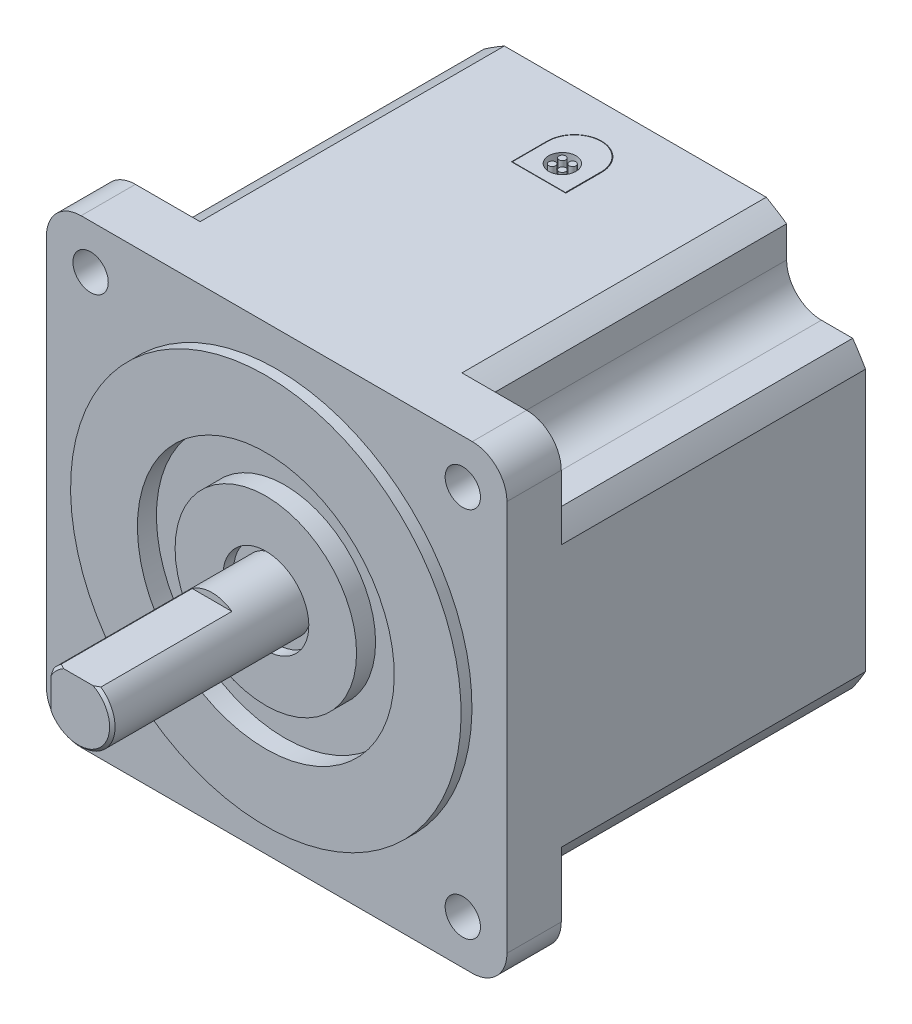
from build123d import *

# Parameters (mm, degrees)
BOSS_EXTRUDE1_DEPTH = 10.16
BOSS_EXTRUDE2_DEPTH = 56.896
SKETCH5_W           = 2.032
SKETCH5_H           = 36.5125
SKETCH6_W           = 3.556
SKETCH6_H           = 7.0485
SKETCH7_W           = 104.14
SKETCH7_H           = 6.35
CHAMFER1_SIZE       = 0.508
CUT_EXTRUDE1_START  = -24.9936
CUT_EXTRUDE1_DEPTH  = 24.9936
SKETCH9_R           = 3.302
CUT_EXTRUDE2_DEPTH  = 10.16
CUT_EXTRUDE3_DEPTH  = 1.9431
SKETCH11_R          = 2.54
BOSS_EXTRUDE3_DEPTH = 1.9685
SKETCH13_R          = 0.635
BOSS_EXTRUDE4_DEPTH = 1.9304


with BuildPart() as part:
    # Sketch3 → Boss-Extrude1 (new body)
    with BuildSketch(Plane.XY):
        with BuildLine():
            Line((-43.053, -36.576), (-43.053, 36.576))
            ThreePointArc((-43.053, 36.576), (-41.155930622, 41.155930622), (-36.576, 43.053))
            Line((-36.576, 43.053), (36.576, 43.053))
            ThreePointArc((36.576, 43.053), (41.155930622, 41.155930622), (43.053, 36.576))
            Line((43.053, 36.576), (43.053, -36.576))
            ThreePointArc((43.053, -36.576), (41.155930622, -41.155930622), (36.576, -43.053))
            Line((36.576, -43.053), (-36.576, -43.053))
            ThreePointArc((-36.576, -43.053), (-41.155930622, -41.155930622), (-43.053, -36.576))
        make_face()
    extrude(amount=-BOSS_EXTRUDE1_DEPTH)

    # Sketch4 → Boss-Extrude2 (add)
    with BuildSketch(Plane.XY.offset(-10.16)):
        with BuildLine():
            Line((-40.651936247, 28.2956), (-34.798, 28.2956))
            ThreePointArc((-34.798, 28.2956), (-30.200108866, 30.200108866), (-28.2956, 34.798))
            Line((-28.2956, 34.798), (-28.2956, 40.651936247))
            ThreePointArc((-28.2956, 40.651936247), (-26.419070342, 41.895747067), (-24.487958081, 43.053))
            Line((-24.487958081, 43.053), (24.487958081, 43.053))
            ThreePointArc((24.487958081, 43.053), (26.419070342, 41.895747067), (28.2956, 40.651936247))
            Line((28.2956, 40.651936247), (28.2956, 34.798))
            ThreePointArc((28.2956, 34.798), (30.200108866, 30.200108866), (34.798, 28.2956))
            Line((34.798, 28.2956), (40.651936247, 28.2956))
            ThreePointArc((40.651936247, 28.2956), (41.895747067, 26.419070342), (43.053, 24.487958081))
            Line((43.053, 24.487958081), (43.053, -24.487958081))
            ThreePointArc((43.053, -24.487958081), (41.895747067, -26.419070342), (40.651936247, -28.2956))
            Line((40.651936247, -28.2956), (34.798, -28.2956))
            ThreePointArc((34.798, -28.2956), (30.200108866, -30.200108866), (28.2956, -34.798))
            Line((28.2956, -34.798), (28.2956, -40.651936247))
            ThreePointArc((28.2956, -40.651936247), (26.419070342, -41.895747067), (24.487958081, -43.053))
            Line((24.487958081, -43.053), (-24.487958081, -43.053))
            ThreePointArc((-24.487958081, -43.053), (-26.419070342, -41.895747067), (-28.2956, -40.651936247))
            Line((-28.2956, -40.651936247), (-28.2956, -34.798))
            ThreePointArc((-28.2956, -34.798), (-30.200108866, -30.200108866), (-34.798, -28.2956))
            Line((-34.798, -28.2956), (-40.651936247, -28.2956))
            ThreePointArc((-40.651936247, -28.2956), (-41.895747067, -26.419070342), (-43.053, -24.487958081))
            Line((-43.053, -24.487958081), (-43.053, 24.487958081))
            ThreePointArc((-43.053, 24.487958081), (-41.895747067, 26.419070342), (-40.651936247, 28.2956))
        make_face()
    extrude(amount=-BOSS_EXTRUDE2_DEPTH)

    # Sketch5 → Revolve1 (revolve)
    with BuildSketch(Plane(origin=(0, 0, 0), x_dir=(0, 0, -1), z_dir=(1, 0, 0))):
        with Locations((-1.016, 18.25625)):
            Rectangle(SKETCH5_W, SKETCH5_H)
    revolve(axis=Axis((0, 0, 0), (0, 0, 1)))

    # Sketch6 → Cut-Revolve1 (revolve, cut)
    with BuildSketch(Plane(origin=(0, 0, 0), x_dir=(0, 0, -1), z_dir=(1, 0, 0)), mode=Mode.PRIVATE) as cut_revolve1_sk:
        Polygon((67.056, 0), (-2.032, 0), (-2.032, 8.0391), (0, 8.0391), (0, 6.35), (67.056, 6.35), align=None)
        with Locations((-0.254, 20.49145)):
            Rectangle(SKETCH6_W, SKETCH6_H)
    revolve(cut_revolve1_sk.sketch.rotate(Axis((0, 0, 37.084), (0, 0, -1)), 180), axis=Axis((0, 0, 37.084), (0, 0, -1)), mode=Mode.SUBTRACT)

    # Sketch9 → Cut-Extrude2 (cut)
    with BuildSketch(Plane.XY):
        with Locations((34.798, -34.798)):
            Circle(SKETCH9_R)
        with Locations((-34.798, -34.798)):
            Circle(SKETCH9_R)
        with Locations((-34.798, 34.798)):
            Circle(SKETCH9_R)
        with Locations((34.798, 34.798)):
            Circle(SKETCH9_R)
    extrude(amount=-CUT_EXTRUDE2_DEPTH, mode=Mode.SUBTRACT)

    # Sketch10 → Cut-Extrude3 (cut)
    with BuildSketch(Plane(origin=(0, 43.053, -0.751200197), x_dir=(1, 0, 0), z_dir=(0, 1, 0))):
        with BuildLine():
            Line((-5.08, 54.925599803), (-5.08, 48.219999803))
            Line((-5.08, 48.219999803), (5.08, 48.219999803))
            Line((5.08, 48.219999803), (5.08, 54.925599803))
            ThreePointArc((5.08, 54.925599803), (0, 60.005599803), (-5.08, 54.925599803))
        make_face()
    extrude(amount=-CUT_EXTRUDE3_DEPTH, mode=Mode.SUBTRACT)

    # Sketch11 → Boss-Extrude3 (add)
    with BuildSketch(Plane(origin=(0, 41.1099, 0), x_dir=(1, 0, 0), z_dir=(0, 1, 0))):
        with BuildLine():
            Line((-4.9657, 55.6768), (-4.9657, 49.022))
            Line((-4.9657, 49.022), (4.9657, 49.022))
            Line((4.9657, 49.022), (4.9657, 55.6768))
            ThreePointArc((4.9657, 55.6768), (0, 60.6425), (-4.9657, 55.6768))
        make_face()
        with Locations(Location((0, 53.4162, 0), (0, 0, 180))):
            Circle(SKETCH11_R, mode=Mode.SUBTRACT)
    extrude(amount=BOSS_EXTRUDE3_DEPTH)

    # Sketch13 → Boss-Extrude4 (add)
    with BuildSketch(Plane(origin=(0, 41.1099, 0), x_dir=(1, 0, 0), z_dir=(0, 1, 0))):
        with Locations(Location((-0.9525, 54.3687, 0), (0, 0, 270))):
            Circle(SKETCH13_R)
        with Locations(Location((0.9525, 54.3687, 0), (0, 0, 270))):
            Circle(SKETCH13_R)
        with Locations(Location((0.9525, 52.4637, 0), (0, 0, 270))):
            Circle(SKETCH13_R)
        with Locations(Location((-0.9525, 52.4637, 0), (0, 0, 270))):
            Circle(SKETCH13_R)
    extrude(amount=BOSS_EXTRUDE4_DEPTH)


with BuildPart() as body_2:
    # Sketch7 → Revolve2 (revolve)
    with BuildSketch(Plane(origin=(0, 0, 0), x_dir=(0, 0, -1), z_dir=(1, 0, 0)), mode=Mode.PRIVATE) as revolve2_sk:
        with Locations((14.986, 3.175)):
            Rectangle(SKETCH7_W, SKETCH7_H)
    revolve(revolve2_sk.sketch.rotate(Axis((0, 0, 37.084), (0, 0, -1)), 180), axis=Axis((0, 0, 37.084), (0, 0, -1)))

    # Chamfer1
    chamfer1_edges = [body_2.edges().sort_by_distance(p)[0] for p in [
        (0, 6.35, 37.084),
        (0, 6.35, -67.056),
    ]]
    chamfer(chamfer1_edges, length=CHAMFER1_SIZE)

    # Sketch8 → Cut-Extrude1 (cut)
    with BuildSketch(Plane.XY.offset(37.084).offset(CUT_EXTRUDE1_START)):
        with BuildLine():
            Line((-5.1562, -3.706224704), (-5.1562, 3.706224704))
            ThreePointArc((-5.1562, 3.706224704), (-6.35, 0), (-5.1562, -3.706224704))
        make_face()
        with BuildLine():
            Line((-3.706224704, 5.1562), (3.706224704, 5.1562))
            ThreePointArc((3.706224704, 5.1562), (0, 6.35), (-3.706224704, 5.1562))
        make_face()
    extrude(amount=CUT_EXTRUDE1_DEPTH, mode=Mode.SUBTRACT)


solid = Compound([part.part, body_2.part])
